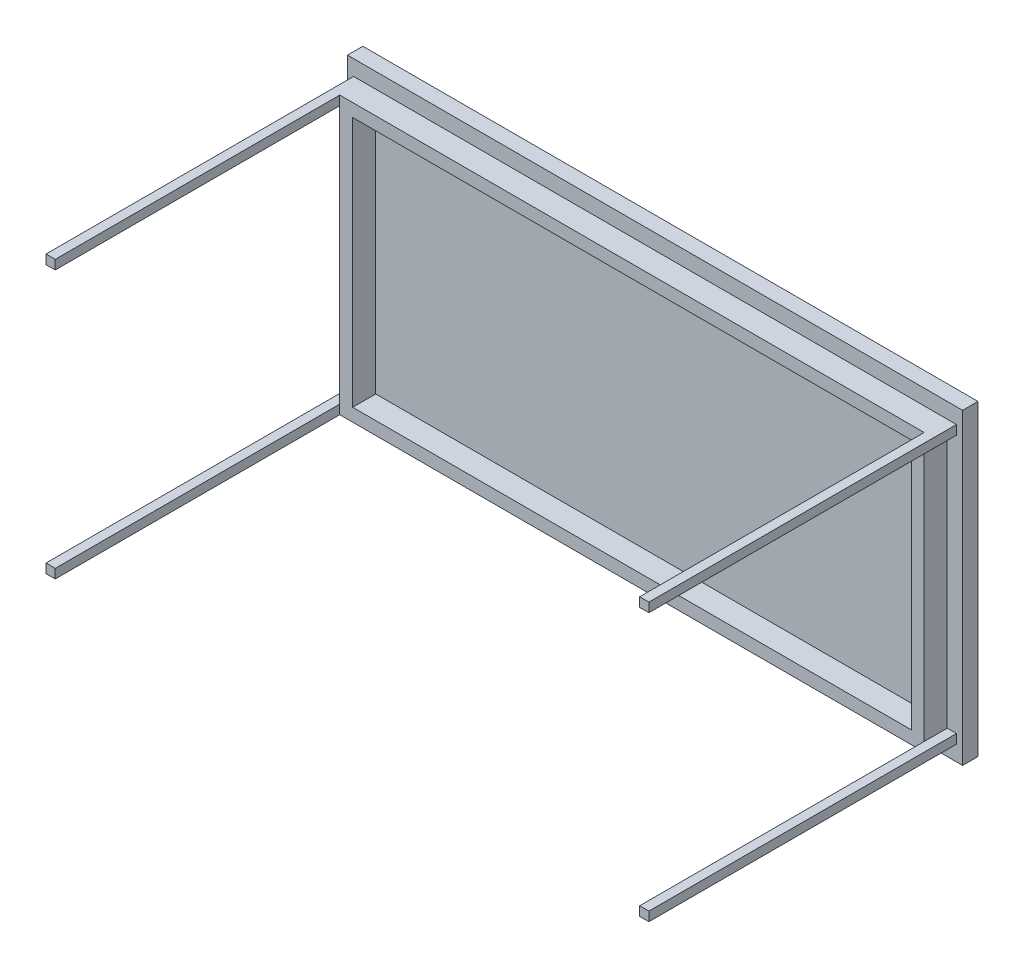
from build123d import *

# Parameters (mm, degrees)
ESQUISSE1_W        = 2000
ESQUISSE1_H        = 1000
BOSS_EXTRU_1_DEPTH = 50
ESQUISSE2_W        = 1900
ESQUISSE2_H        = 900
ESQUISSE2_W_2      = 1816
ESQUISSE2_H_2      = 816
BOSS_EXTRU_2_DEPTH = 75
ESQUISSE3_W        = 30
ESQUISSE3_H        = 30
BOSS_EXTRU_3_DEPTH = 1000


with BuildPart() as part:
    # Esquisse1 → Boss.-Extru.1 (new body)
    with BuildSketch(Plane.XY):
        Rectangle(ESQUISSE1_W, ESQUISSE1_H)
    extrude(amount=BOSS_EXTRU_1_DEPTH)

    # Esquisse2 → Boss.-Extru.2 (add)
    with BuildSketch(Plane.XY.offset(50)):
        Rectangle(ESQUISSE2_W, ESQUISSE2_H)
        Rectangle(ESQUISSE2_W_2, ESQUISSE2_H_2, mode=Mode.SUBTRACT)
    extrude(amount=BOSS_EXTRU_2_DEPTH)

    # Esquisse3 → Boss.-Extru.3 (add)
    with BuildSketch(Plane.XY.offset(50)):
        with Locations((-965, 435)):
            Rectangle(ESQUISSE3_W, ESQUISSE3_H)
        with Locations((965, 435)):
            Rectangle(ESQUISSE3_W, ESQUISSE3_H)
        with Locations((965, -435)):
            Rectangle(ESQUISSE3_W, ESQUISSE3_H)
        with Locations((-965, -435)):
            Rectangle(ESQUISSE3_W, ESQUISSE3_H)
    extrude(amount=BOSS_EXTRU_3_DEPTH)


solid = part.part
